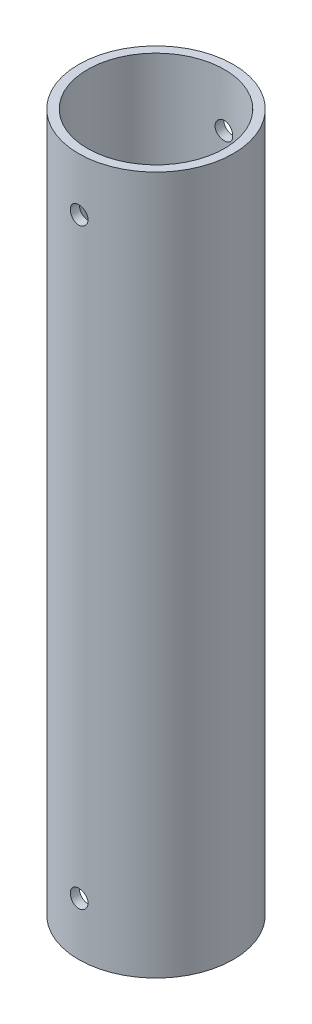
from build123d import *

# Parameters (mm, degrees)
ESQUISSE1_R                  = 17.5
ESQUISSE1_R_2                = 15.5
BOSS_EXTRU_1_DEPTH           = 158
ENL_V_MAT_EXTRU_1_DEPTH      = 160.926545639
ENL_V_MAT_EXTRU_1_DEPTH_BACK = 160.926545639
ESQUISSE2_R                  = 2


with BuildPart() as part:
    # Esquisse1 → Boss.-Extru.1 (new body)
    with BuildSketch(Plane(origin=(0, 0, 0), x_dir=(1, 0, 0), z_dir=(0, 1, 0))):
        with Locations(Location((0, 0, 0), (0, 0, 270))):
            Circle(ESQUISSE1_R)
        with Locations(Location((0, 0, 0), (0, 0, 270))):
            Circle(ESQUISSE1_R_2, mode=Mode.SUBTRACT)
    extrude(amount=BOSS_EXTRU_1_DEPTH)

    # Esquisse2 → Enlèv. mat.-Extru.1 (cut, two sides: drawn at the far end of the back side and taken through both)
    with BuildSketch(Plane.XY.offset(-ENL_V_MAT_EXTRU_1_DEPTH_BACK)):
        with Locations((0, 146)):
            Circle(ESQUISSE2_R)
        with Locations((0, 12)):
            Circle(ESQUISSE2_R)
    extrude(amount=ENL_V_MAT_EXTRU_1_DEPTH + ENL_V_MAT_EXTRU_1_DEPTH_BACK, mode=Mode.SUBTRACT)


solid = part.part
